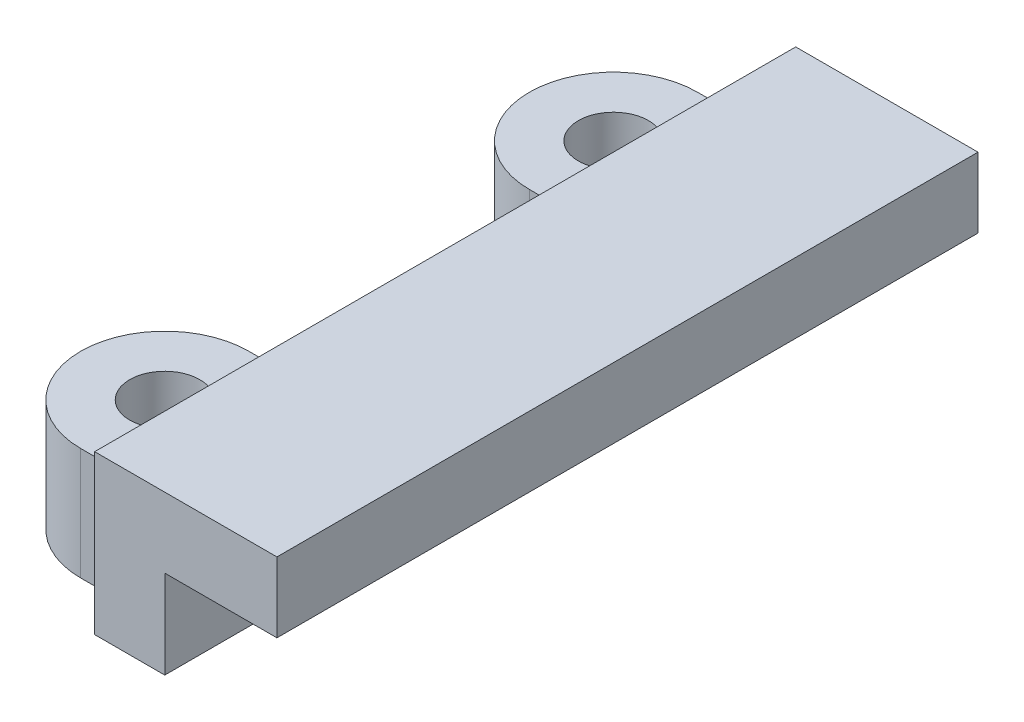
from build123d import *

# Parameters (mm, degrees)
CROQUIS4_W                = 13
CROQUIS4_H                = 11.3
SALIENTE_EXTRUIR1_DEPTH   = 161
CROQUIS5_W                = 151
CROQUIS5_H                = 3.5
CORTAR_EXTRUIR1_DEPTH     = 6.3
SALIENTE_EXTRUIR3_DEPTH   = 8
CROQUIS9_R                = 2.5
CORTAR_EXTRUIR3_DEPTH     = 179.518038304
SIMETR_A8_COPY_1_DEPTH    = 8
SIMETR_A8_COPY_2_SKETCH_R = 2.5
SIMETR_A8_COPY_2_DEPTH    = 179.518038304
CROQUIS10_R               = 2.5
CORTAR_EXTRUIR4_DEPTH     = 179.518038304
MATRIZL1_COUNT            = 3
MATRIZL1_PITCH            = 40.5
CROQUIS11_W               = 64.853728184
CROQUIS11_H               = 22.965019475
CORTAR_EXTRUIR5_DEPTH     = 167.107465215
CROQUIS12_W               = 8
CROQUIS12_H               = 6.3
CORTAR_EXTRUIR6_DEPTH     = 45.010680522


with BuildPart() as part:
    # Barrer1: sweep along a path in Croquis3
    with BuildLine(Plane(origin=(0, 0, 0), x_dir=(1, 0, 0), z_dir=(0, 1, 0))) as barrer1_path:
        Line((0, 0), (0, -37))
    # Croquis1 → Barrer1 (sweep)
    with BuildSketch(Plane.XY):
        Polygon((0, 0), (0, 11.3), (13, 11.3), (13, 6.3), (5, 6.3), (5, 0), align=None)
    barrer1 = sweep(path=barrer1_path.line)

    # Croquis4 → Saliente-Extruir1 (add)
    with BuildSketch(Plane.ZY):
        with Locations((43.5, 5.65)):
            Rectangle(CROQUIS4_W, CROQUIS4_H)
    extrude(amount=-SALIENTE_EXTRUIR1_DEPTH)

    # Simetría5: Barrer1 across plane
    add(barrer1.mirror(Plane.ZY.offset(-80.5)))

    # Croquis5 → Cortar-Extruir1 (cut)
    with BuildSketch(Plane.XZ):
        with Locations((80.5, 38.75)):
            Rectangle(CROQUIS5_W, CROQUIS5_H)
    extrude(amount=-CORTAR_EXTRUIR1_DEPTH, mode=Mode.SUBTRACT)

    # Croquis8 → Saliente-Extruir3 (add)
    with BuildSketch(Plane.XZ):
        with BuildLine():
            Line((161, 47), (165, 47))
            ThreePointArc((165, 47), (171, 41), (165, 35))
            Line((165, 35), (161, 35))
            Line((161, 35), (161, 47))
        make_face()
    saliente_extruir3 = extrude(amount=-SALIENTE_EXTRUIR3_DEPTH)

    # Croquis9 → Cortar-Extruir3 (cut, through all)
    with BuildSketch(Plane.XZ):
        with Locations((165, 41)):
            Circle(CROQUIS9_R)
    cortar_extruir3 = extrude(amount=-CORTAR_EXTRUIR3_DEPTH, mode=Mode.SUBTRACT)

    # Simetría7: Saliente-Extruir3, Cortar-Extruir3 across plane
    add(saliente_extruir3.mirror(Plane(origin=(0, 0, 25), x_dir=(1, 0, 0), z_dir=(0, 0, -1))))
    add(cortar_extruir3.mirror(Plane(origin=(0, 0, 25), x_dir=(1, 0, 0), z_dir=(0, 0, -1))), mode=Mode.SUBTRACT)

    # Simetría8: Saliente-Extruir3, Cortar-Extruir3 across plane
    add(saliente_extruir3.mirror(Plane.ZY.offset(-80.5)))
    add(cortar_extruir3.mirror(Plane.ZY.offset(-80.5)), mode=Mode.SUBTRACT)

    # Simetría8 copy 1 sketch → Simetría8 copy 1 (add)
    with BuildSketch(Plane(origin=(161, 0, 50), x_dir=(-1, 0, 0), z_dir=(0, -1, 0))):
        with BuildLine():
            Line((161, 47), (165, 47))
            ThreePointArc((165, 47), (171, 41), (165, 35))
            Line((165, 35), (161, 35))
            Line((161, 35), (161, 47))
        make_face()
    extrude(amount=-SIMETR_A8_COPY_1_DEPTH)

    # Simetría8 copy 2 sketch → Simetría8 copy 2 (cut, through all)
    with BuildSketch(Plane(origin=(161, 0, 50), x_dir=(-1, 0, 0), z_dir=(0, -1, 0))):
        with Locations((165, 41)):
            Circle(SIMETR_A8_COPY_2_SKETCH_R)
    extrude(amount=-SIMETR_A8_COPY_2_DEPTH, mode=Mode.SUBTRACT)

    # Croquis10 → Cortar-Extruir4 (cut, through all)
    with BuildSketch(Plane(origin=(0, 11.3, 0), x_dir=(1, 0, 0), z_dir=(0, 1, 0))):
        with Locations(Location((121, -45.25, 0), (0, 0, 270))):
            Circle(CROQUIS10_R)
    cortar_extruir4 = extrude(amount=-CORTAR_EXTRUIR4_DEPTH, mode=Mode.SUBTRACT)

    # MatrizL1: Cortar-Extruir4 ×3
    with Locations(*[(-i * MATRIZL1_PITCH, 0, 0) for i in range(1, MATRIZL1_COUNT)]):
        add(cortar_extruir4, mode=Mode.SUBTRACT)

    # Croquis11 → Cortar-Extruir5 (cut, through all)
    with BuildSketch(Plane(origin=(13, 0, 0), x_dir=(0, 0, -1), z_dir=(1, 0, 0))):
        with Locations((-26.956517022, 7.895183468)):
            Rectangle(CROQUIS11_W, CROQUIS11_H)
    extrude(amount=CORTAR_EXTRUIR5_DEPTH, mode=Mode.SUBTRACT)

    # Croquis12 → Cortar-Extruir6 (cut, through all)
    with BuildSketch(Plane(origin=(0, 0, 40.5), x_dir=(-1, 0, 0), z_dir=(0, 0, -1))):
        with Locations((-9, 3.15)):
            Rectangle(CROQUIS12_W, CROQUIS12_H)
    extrude(amount=-CORTAR_EXTRUIR6_DEPTH, mode=Mode.SUBTRACT)


solid = part.part
